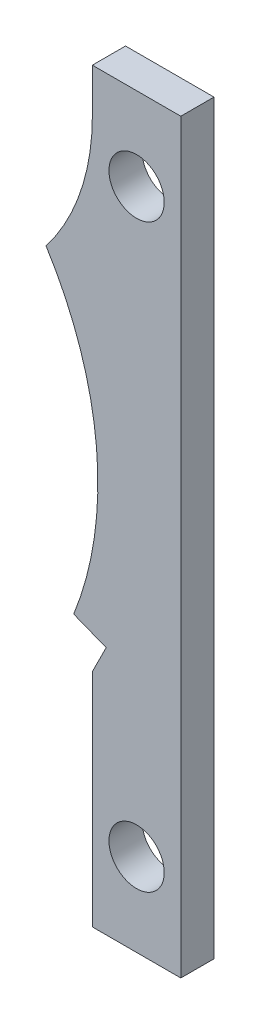
from build123d import *

# Parameters (mm, degrees)
BOSS_EXTRUDE1_DEPTH        = 3
F_10_0_10_DIAMETER_HOLE1_D = 10


with BuildPart() as part:
    # Sketch1 → Boss-Extrude1 (new, symmetric)
    with BuildSketch(Plane.XY):
        with BuildLine():
            Line((59.999997079, 62), (59.999997079, 57))
            ThreePointArc((59.999997079, 57), (57.847096138, 44.054070414), (51.620142438, 32.501706028))
            ThreePointArc((51.620142438, 32.501706028), (60.750395332, 5.512664234), (56.627398554, -22.679015256))
            Line((56.627398554, -22.679015256), (60, -24.011943529))
            Line((60, -24.011943529), (62.5, -25))
            Line((62.5, -25), (60, -30))
            Line((60, -30), (60, -70))
            Line((60, -70), (75.999997079, -70))
            Line((75.999997079, -70), (75.999997079, 62))
            Line((75.999997079, 62), (75.999997079, 65))
            Line((75.999997079, 65), (59.999997079, 65))
            Line((59.999997079, 65), (59.999997079, 62))
        make_face()
    extrude(amount=BOSS_EXTRUDE1_DEPTH, both=True)

    # Ø10.0 (10) Diameter Hole1 (through all)
    with Locations(Plane(origin=(67.999997079, 50, 3), x_dir=(1, 0, 0), z_dir=(0, 0, 1))):
        with Locations((0, 0), (0, -105)):
            Hole(F_10_0_10_DIAMETER_HOLE1_D / 2)


solid = part.part
